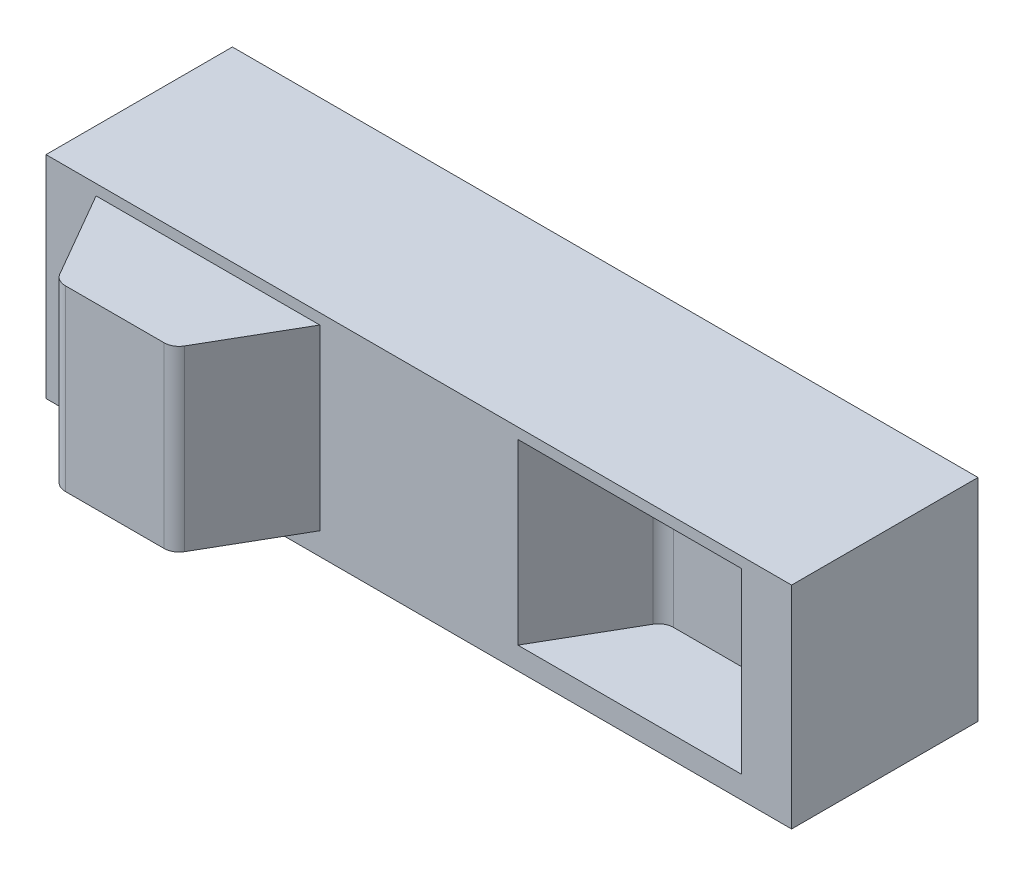
from build123d import *

# Parameters (mm, degrees)
SKETCH1_W                = 100
SKETCH1_H                = 25
BOSS_EXTRUDE1_DEPTH      = 14.1675
BOSS_EXTRUDE2_DEPTH      = 12.7325
BOSS_EXTRUDE2_DEPTH_BACK = 11.1675
FILLET1_R                = 2
CUT_EXTRUDE1_DEPTH       = 12.7325
CUT_EXTRUDE1_DEPTH_BACK  = 11.1675
FILLET2_R                = 2


with BuildPart() as part:
    # Sketch1 → Boss-Extrude1 (new, symmetric)
    with BuildSketch(Plane(origin=(0, 0, 0), x_dir=(1, 0, 0), z_dir=(0, 1, 0))):
        with Locations((0, 12.5)):
            Rectangle(SKETCH1_W, SKETCH1_H)
    extrude(amount=BOSS_EXTRUDE1_DEPTH, both=True)

    # Sketch2 → Boss-Extrude2 (add, two sides: drawn at the far end of the back side and taken through both)
    with BuildSketch(Plane(origin=(0, 0, 0), x_dir=(1, 0, 0), z_dir=(0, 1, 0)).offset(-BOSS_EXTRUDE2_DEPTH_BACK)):
        Polygon((-43.283333333, 0), (-13.283333333, 0), (-20.500211698, -12.5), (-36.066454968, -12.5), align=None)
    extrude(amount=BOSS_EXTRUDE2_DEPTH + BOSS_EXTRUDE2_DEPTH_BACK)

    # Fillet1
    fillet1_edges = [part.edges().sort_by_distance(p)[0] for p in [
        (-20.500211698, 0.7825, 12.5),
        (-36.066454968, 0.7825, 12.5),
    ]]
    fillet(fillet1_edges, radius=FILLET1_R)

    # Sketch2<3> → Cut-Extrude1 (cut, two sides: drawn at the far end of the back side and taken through both)
    with BuildSketch(Plane(origin=(0, 0, 0), x_dir=(1, 0, 0), z_dir=(0, 1, 0)).offset(-CUT_EXTRUDE1_DEPTH_BACK)):
        Polygon((36.066454968, 12.5), (20.500211698, 12.5), (13.283333333, 0), (43.283333333, 0), align=None)
    extrude(amount=CUT_EXTRUDE1_DEPTH + CUT_EXTRUDE1_DEPTH_BACK, mode=Mode.SUBTRACT)

    # Fillet2
    fillet2_edges = [part.edges().sort_by_distance(p)[0] for p in [
        (36.066454968, 0.7825, -12.5),
        (20.500211698, 0.7825, -12.5),
    ]]
    fillet(fillet2_edges, radius=FILLET2_R)


solid = part.part
